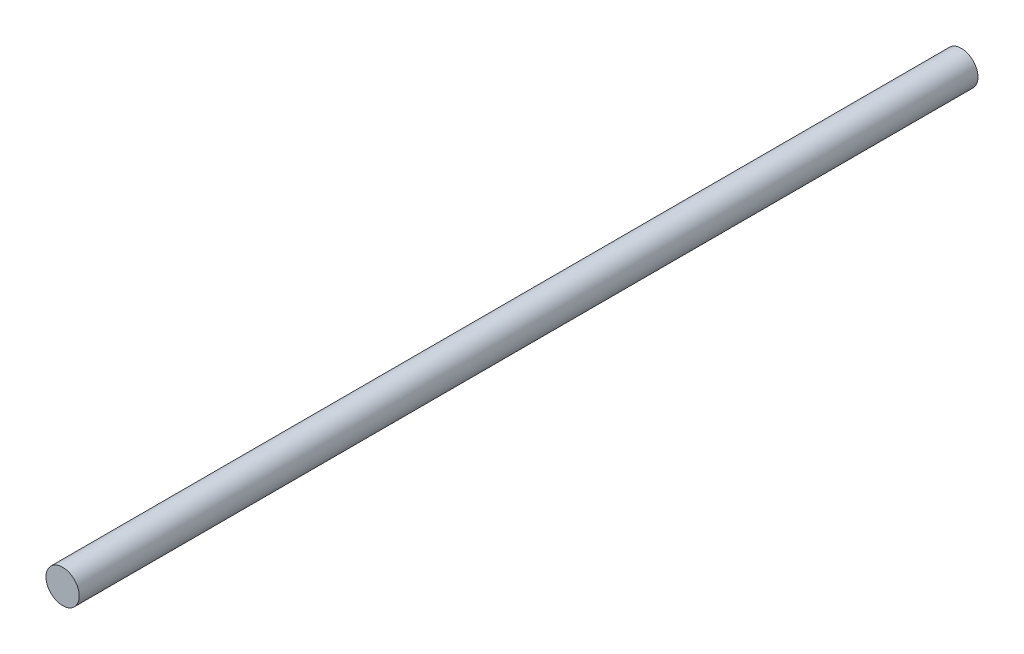
from build123d import *

# Parameters (mm, degrees)
SKETCH1_R           = 2.5
BOSS_EXTRUDE1_DEPTH = 135


with BuildPart() as part:
    # Sketch1 → Boss-Extrude1 (new body)
    with BuildSketch(Plane.XY):
        Circle(SKETCH1_R)
    extrude(amount=BOSS_EXTRUDE1_DEPTH)


solid = part.part
